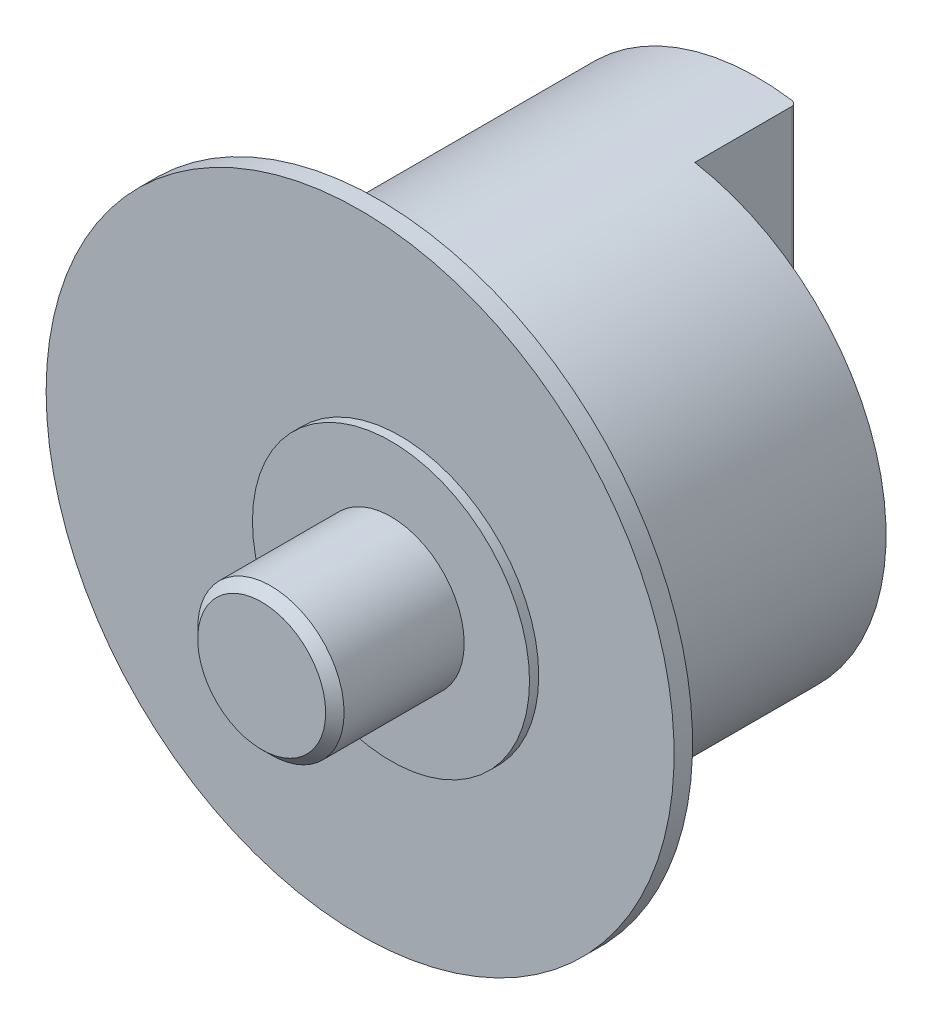
from build123d import *

# Parameters (mm, degrees)
SKETCH1_R           = 12.475
BOSS_EXTRUDE1_DEPTH = 10.5
SKETCH6_R           = 12.475
BOSS_EXTRUDE7_DEPTH = 4.5
SKETCH3_R           = 17
BOSS_EXTRUDE3_DEPTH = 1
SKETCH4_R           = 7.5
BOSS_EXTRUDE5_DEPTH = 0.5
SKETCH5_R           = 3.9625
BOSS_EXTRUDE6_DEPTH = 7
BOSS_EXTRUDE8_START = 5.5
BOSS_EXTRUDE8_DEPTH = 5.5
CHAMFER1_SIZE       = 0.5
FILLET1_R           = 0.25


with BuildPart() as part:
    # Sketch1 → Boss-Extrude1 (new body)
    # profile 1 of 2: a face of its own
    with BuildSketch(Plane.XY):
        with BuildLine():
            Line((-4, 0), (-2, 3.464101615))
            ThreePointArc((-2, 3.464101615), (-3.464101615, 2), (-4, 0))
        make_face()
    # profile 2 of 2: a face of its own
    with BuildSketch(Plane.XY):
        with Locations(Location((-2.17, 0, 0), (0, 0, 180))):
            Circle(SKETCH1_R)
        Polygon((1.985566243, -3.439101615), (3.971132487, 0), (1.985566243, 3.439101615), (-1.985566243, 3.439101615), (-3.971132487, 0), (-1.985566243, -3.439101615), align=None, mode=Mode.SUBTRACT)
    extrude(amount=BOSS_EXTRUDE1_DEPTH)

    # Sketch6 → Boss-Extrude7 (add)
    with BuildSketch(Plane.XY.offset(10.5)):
        with Locations(Location((-2.17, 0, 0), (0, 0, 180))):
            Circle(SKETCH6_R)
    extrude(amount=BOSS_EXTRUDE7_DEPTH)

    # Sketch3 → Boss-Extrude3 (add)
    with BuildSketch(Plane(origin=(0, 0, 15), x_dir=(-1, 0, 0), z_dir=(0, 0, -1))):
        with Locations((2.17, 0)):
            Circle(SKETCH3_R)
    extrude(amount=-BOSS_EXTRUDE3_DEPTH)

    # Sketch4 → Boss-Extrude5 (add)
    with BuildSketch(Plane.XY.offset(16)):
        Circle(SKETCH4_R)
    extrude(amount=BOSS_EXTRUDE5_DEPTH)

    # Sketch5 → Boss-Extrude6 (add)
    with BuildSketch(Plane.XY.offset(16.5)):
        Circle(SKETCH5_R)
    extrude(amount=BOSS_EXTRUDE6_DEPTH)

    # Sketch7 → Boss-Extrude8 (add)
    with BuildSketch(Plane(origin=(0, 0, 0), x_dir=(-1, 0, 0), z_dir=(0, 0, -1)).offset(BOSS_EXTRUDE8_START)):
        with BuildLine():
            ThreePointArc((14.645, 0), (10.206747632, 9.541295116), (0.05, 12.293544037))
            Line((0.05, 12.293544037), (0.05, 3.439101615))
            Line((0.05, 3.439101615), (1.985566243, 3.439101615))
            Line((1.985566243, 3.439101615), (3.971132487, 0))
            Line((3.971132487, 0), (1.985566243, -3.439101615))
            Line((1.985566243, -3.439101615), (0.05, -3.439101615))
            Line((0.05, -3.439101615), (0.05, -12.293544037))
            ThreePointArc((0.05, -12.293544037), (10.206747632, -9.541295116), (14.645, 0))
        make_face()
    extrude(amount=-BOSS_EXTRUDE8_DEPTH)

    # Chamfer1
    chamfer1_edges = [part.edges().sort_by_distance(p)[0] for p in [
        (-3.9625, 0, 23.5),
    ]]
    chamfer(chamfer1_edges, length=CHAMFER1_SIZE)

    # Fillet1
    fillet1_edges = [part.edges().sort_by_distance(p)[0] for p in [
        (-0.05, 7.866322826, -5.5),
        (-0.05, -7.866322826, -5.5),
    ]]
    fillet(fillet1_edges, radius=FILLET1_R)


solid = part.part
